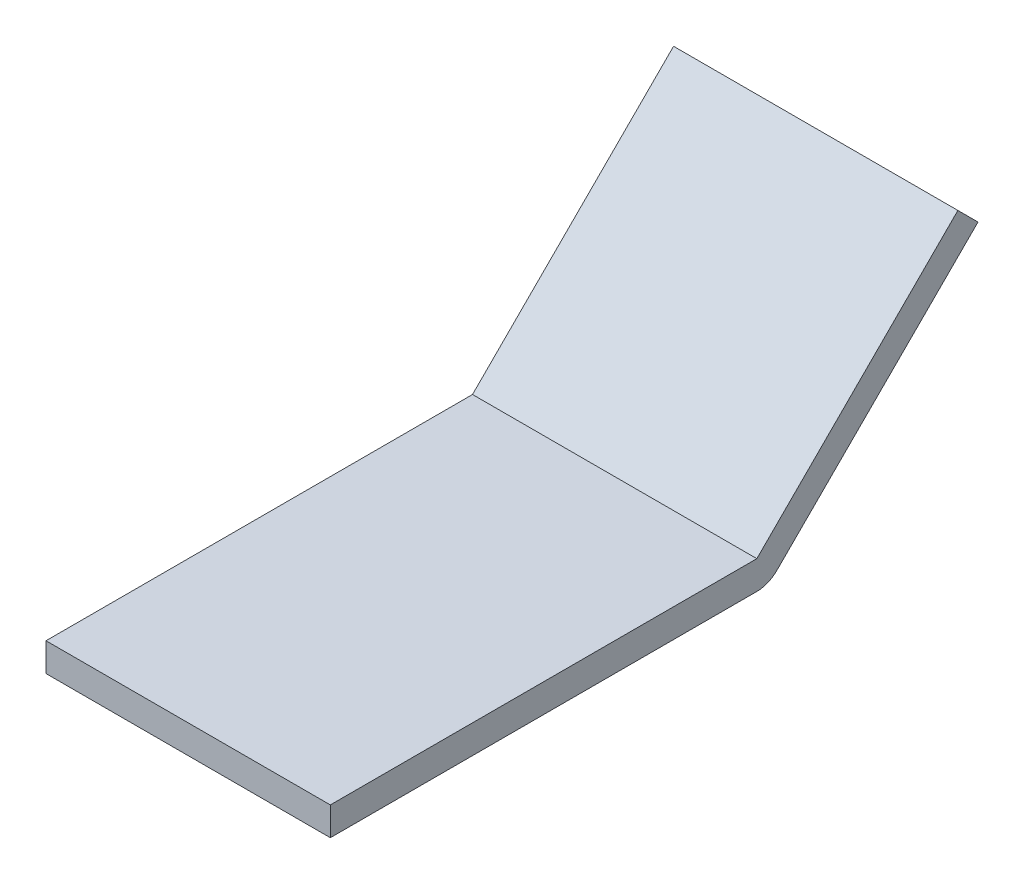
from build123d import *

# Parameters (mm, degrees)
EXTRUDE1_DEPTH = 120


with BuildPart() as part:
    # Sketch1 → Extrude1 (new body)
    with BuildSketch(Plane(origin=(0, 0, 0), x_dir=(0, 0, -1), z_dir=(1, 0, 0))):
        with BuildLine():
            Line((0, 0), (180, 0))
            Line((180, 0), (264.852813742, 84.852813742))
            Line((264.852813742, 84.852813742), (273.338095117, 76.367532368))
            Line((273.338095117, 76.367532368), (188.485281374, -8.485281374))
            ThreePointArc((188.485281374, -8.485281374), (184.592201188, -11.08655439), (180, -12))
            Line((180, -12), (0, -12))
            Line((0, -12), (0, 0))
        make_face()
    extrude(amount=EXTRUDE1_DEPTH)


solid = part.part
